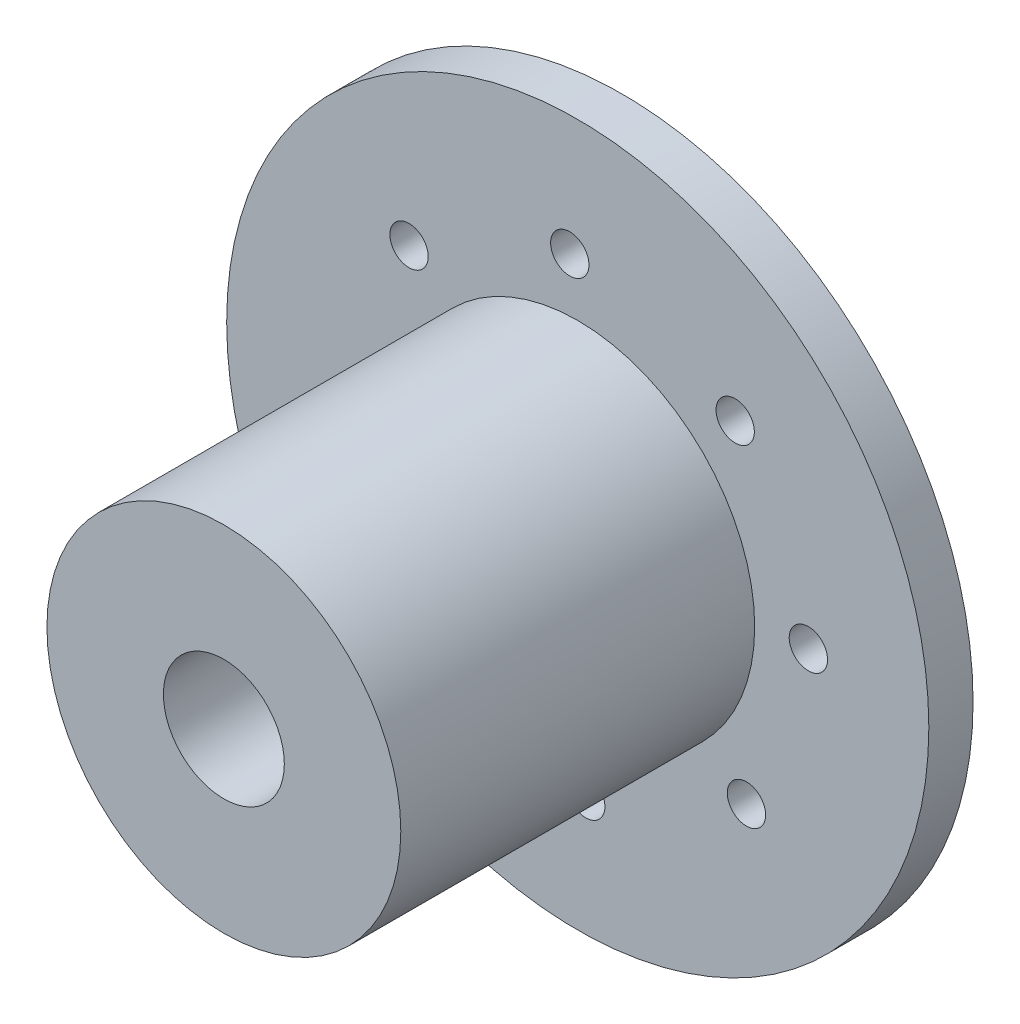
from build123d import *

# Parameters (mm, degrees)
ESQUISSE1_R             = 23.81
BOSS_EXTRU_1_DEPTH      = 3
ESQUISSE2_R             = 12
BOSS_EXTRU_2_DEPTH      = 24
ESQUISSE3_R             = 1.3
ENL_V_MAT_EXTRU_1_DEPTH = 24
ESQUISSE4_R             = 4.1
ENL_V_MAT_EXTRU_2_DEPTH = 18
ESQUISSE5_R             = 0.4
ENL_V_MAT_EXTRU_3_DEPTH = 10
ENL_V_START             = -5
ESQUISSE6_R             = 4.1
ENL_V_MAT_EXTRU_4_DEPTH = 5


with BuildPart() as part:
    # Esquisse1 → Boss.-Extru.1 (new body)
    with BuildSketch(Plane.XY):
        Circle(ESQUISSE1_R)
    extrude(amount=BOSS_EXTRU_1_DEPTH)

    # Esquisse2 → Boss.-Extru.2 (add)
    with BuildSketch(Plane.XY.offset(3)):
        Circle(ESQUISSE2_R)
    extrude(amount=BOSS_EXTRU_2_DEPTH)

    # Esquisse3 → Enlèv. mat.-Extru.1 (cut)
    with BuildSketch(Plane.XY.offset(3)):
        with Locations((-11.442120986, 10.677095455)):
            Circle(ESQUISSE3_R)
        with Locations((-0.540954741, 15.64064794)):
            Circle(ESQUISSE3_R)
        with Locations((10.677095455, 11.442120986)):
            Circle(ESQUISSE3_R)
        with Locations((15.64064794, 0.540954741)):
            Circle(ESQUISSE3_R)
        with Locations((11.442120986, -10.677095455)):
            Circle(ESQUISSE3_R)
        with Locations((0.540954741, -15.64064794)):
            Circle(ESQUISSE3_R)
        with Locations((-10.677095455, -11.442120986)):
            Circle(ESQUISSE3_R)
        with Locations((-15.64064794, -0.540954741)):
            Circle(ESQUISSE3_R)
    extrude(amount=-ENL_V_MAT_EXTRU_1_DEPTH, mode=Mode.SUBTRACT)

    # Esquisse4 → Enlèv. mat.-Extru.2 (cut)
    with BuildSketch(Plane.XY.offset(27)):
        Circle(ESQUISSE4_R)
    extrude(amount=-ENL_V_MAT_EXTRU_2_DEPTH, mode=Mode.SUBTRACT)

    # Esquisse5 → Enlèv. mat.-Extru.3 (cut)
    with BuildSketch(Plane(origin=(0, 0, 0), x_dir=(-1, 0, 0), z_dir=(0, 0, -1))):
        Circle(ESQUISSE5_R)
    extrude(amount=-ENL_V_MAT_EXTRU_3_DEPTH, mode=Mode.SUBTRACT)

    # Esquisse6 → Enlèv. mat.-Extru.4 (cut)
    with BuildSketch(Plane(origin=(0, 0, 0), x_dir=(-1, 0, 0), z_dir=(0, 0, -1)).offset(ENL_V_START)):
        Circle(ESQUISSE6_R)
    extrude(amount=ENL_V_MAT_EXTRU_4_DEPTH, mode=Mode.SUBTRACT)


solid = part.part
